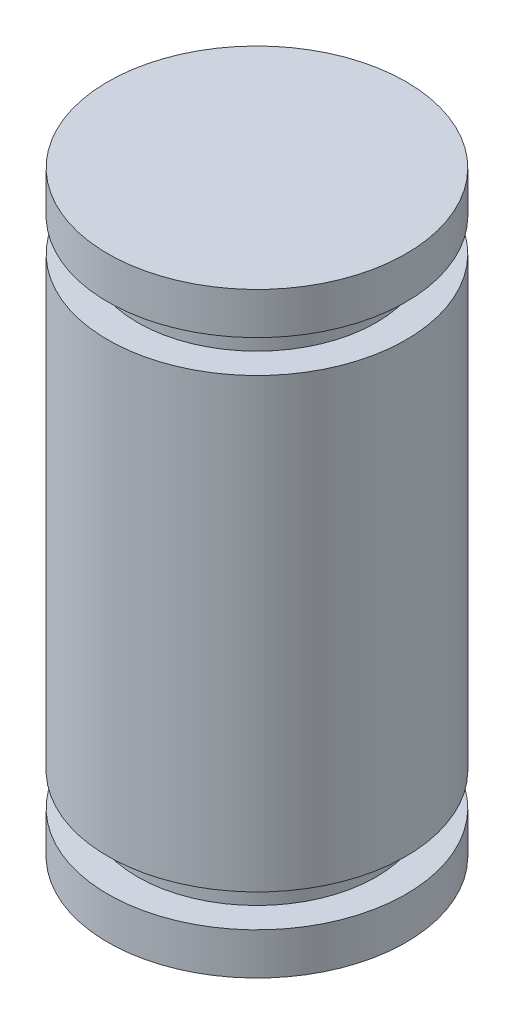
from build123d import *


with BuildPart() as part:
    # 草图1 → 旋转1 (revolve)
    with BuildSketch(Plane.XY, mode=Mode.PRIVATE) as revolve_1_sk:
        Polygon((0, 0), (-5, 0), (-5, 1.4), (-4, 1.4), (-4, 2.5), (-5, 2.5), (-5, 17.5), (-4, 17.5), (-4, 18.6), (-5, 18.6), (-5, 20), (0, 20), align=None)
    revolve(revolve_1_sk.sketch.rotate(Axis((0, 0, 0), (0, 1, 0)), 270), axis=Axis((0, 0, 0), (0, 1, 0)))


solid = part.part
